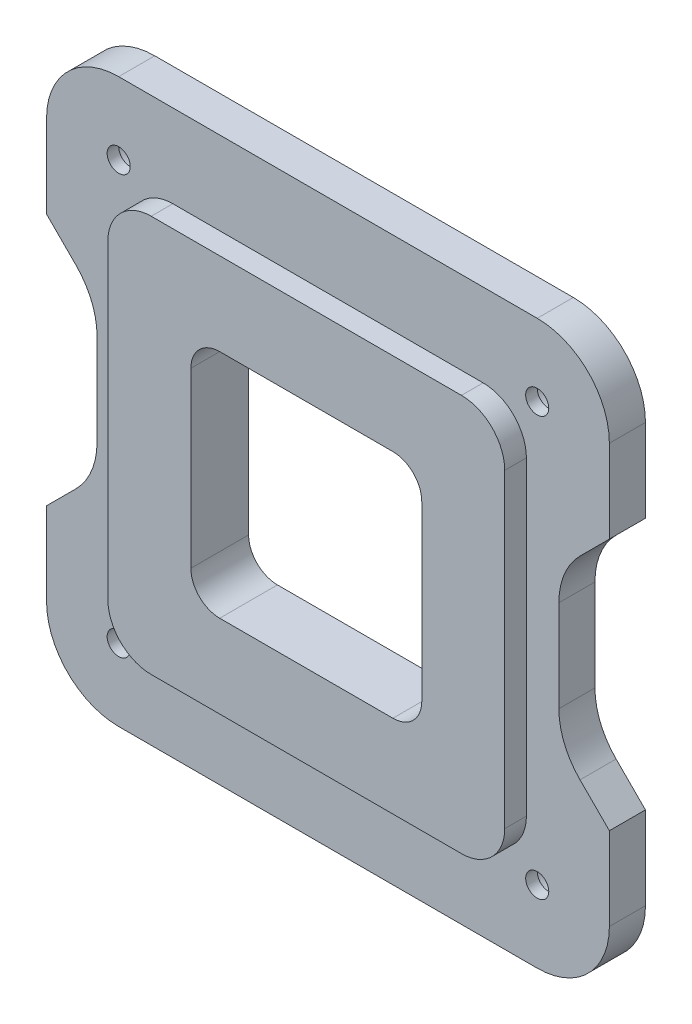
from build123d import *

# Parameters (mm, degrees)
BOSS_EXTRUDE1_DEPTH                                 = 5
BOSS_EXTRUDE2_DEPTH                                 = 3
CUT_EXTRUDE1_DEPTH                                  = 56.731499172
CUT_EXTRUDE1_DEPTH_BACK                             = 56.731499172
CBORE_FOR_M3_HEX_SOCKET_HEAD_CAP_SCREW1_D           = 3.2
CBORE_FOR_M3_HEX_SOCKET_HEAD_CAP_SCREW1_CBORE_D     = 6.5
CBORE_FOR_M3_HEX_SOCKET_HEAD_CAP_SCREW1_CBORE_DEPTH = 3.4


with BuildPart() as part:
    # Sketch1 → Boss-Extrude1 (new body)
    with BuildSketch(Plane.XY):
        with BuildLine():
            Line((-29, 39), (29, 39))
            ThreePointArc((29, 39), (36.071067812, 36.071067812), (39, 29))
            Line((39, 29), (39, 17.5))
            Line((39, 17.5), (34.928932188, 13.428932188))
            ThreePointArc((34.928932188, 13.428932188), (32.761204675, 10.1846987), (32, 6.357864376))
            Line((32, 6.357864376), (32, -6.357864376))
            ThreePointArc((32, -6.357864376), (32.761204675, -10.1846987), (34.928932188, -13.428932188))
            Line((34.928932188, -13.428932188), (39, -17.5))
            Line((39, -17.5), (39, -29))
            ThreePointArc((39, -29), (36.071067812, -36.071067812), (29, -39))
            Line((29, -39), (-29, -39))
            ThreePointArc((-29, -39), (-36.071067812, -36.071067812), (-39, -29))
            Line((-39, -29), (-39, -17.5))
            Line((-39, -17.5), (-34.928932188, -13.428932188))
            ThreePointArc((-34.928932188, -13.428932188), (-32.761204675, -10.1846987), (-32, -6.357864376))
            Line((-32, -6.357864376), (-32, 6.357864376))
            ThreePointArc((-32, 6.357864376), (-32.761204675, 10.1846987), (-34.928932188, 13.428932188))
            Line((-34.928932188, 13.428932188), (-39, 17.5))
            Line((-39, 17.5), (-39, 29))
            ThreePointArc((-39, 29), (-36.071067812, 36.071067812), (-29, 39))
        make_face()
    extrude(amount=BOSS_EXTRUDE1_DEPTH)

    # Sketch2 → Boss-Extrude2 (add)
    with BuildSketch(Plane(origin=(0, 0, 5), x_dir=(-1, 0, 0), z_dir=(0, 0, -1))):
        with BuildLine():
            Line((-21.5, 27.5), (21.5, 27.5))
            ThreePointArc((21.5, 27.5), (25.742640687, 25.742640687), (27.5, 21.5))
            Line((27.5, 21.5), (27.5, -21.5))
            ThreePointArc((27.5, -21.5), (25.742640687, -25.742640687), (21.5, -27.5))
            Line((21.5, -27.5), (-21.5, -27.5))
            ThreePointArc((-21.5, -27.5), (-25.742640687, -25.742640687), (-27.5, -21.5))
            Line((-27.5, -21.5), (-27.5, 21.5))
            ThreePointArc((-27.5, 21.5), (-25.742640687, 25.742640687), (-21.5, 27.5))
        make_face()
    extrude(amount=-BOSS_EXTRUDE2_DEPTH)

    # Sketch3 → Cut-Extrude1 (cut, two sides: drawn at the far end of the back side and taken through both)
    with BuildSketch(Plane(origin=(0, 0, 0), x_dir=(-1, 0, 0), z_dir=(0, 0, -1)).offset(-CUT_EXTRUDE1_DEPTH_BACK)):
        with BuildLine():
            Line((-12, -16), (12, -16))
            ThreePointArc((12, -16), (14.828427125, -14.828427125), (16, -12))
            Line((16, -12), (16, 12))
            ThreePointArc((16, 12), (14.828427125, 14.828427125), (12, 16))
            Line((12, 16), (-12, 16))
            ThreePointArc((-12, 16), (-14.828427125, 14.828427125), (-16, 12))
            Line((-16, 12), (-16, -12))
            ThreePointArc((-16, -12), (-14.828427125, -14.828427125), (-12, -16))
        make_face()
    extrude(amount=CUT_EXTRUDE1_DEPTH + CUT_EXTRUDE1_DEPTH_BACK, mode=Mode.SUBTRACT)

    # CBORE for M3 Hex Socket Head Cap Screw1 (through all)
    with Locations(Plane(origin=(0, 0, 0), x_dir=(-1, 0, 0), z_dir=(0, 0, -1))):
        with Locations((29, -29), (29, 29), (-29, 29), (-29, -29)):
            CounterBoreHole(CBORE_FOR_M3_HEX_SOCKET_HEAD_CAP_SCREW1_D / 2, CBORE_FOR_M3_HEX_SOCKET_HEAD_CAP_SCREW1_CBORE_D / 2, CBORE_FOR_M3_HEX_SOCKET_HEAD_CAP_SCREW1_CBORE_DEPTH)


solid = part.part
